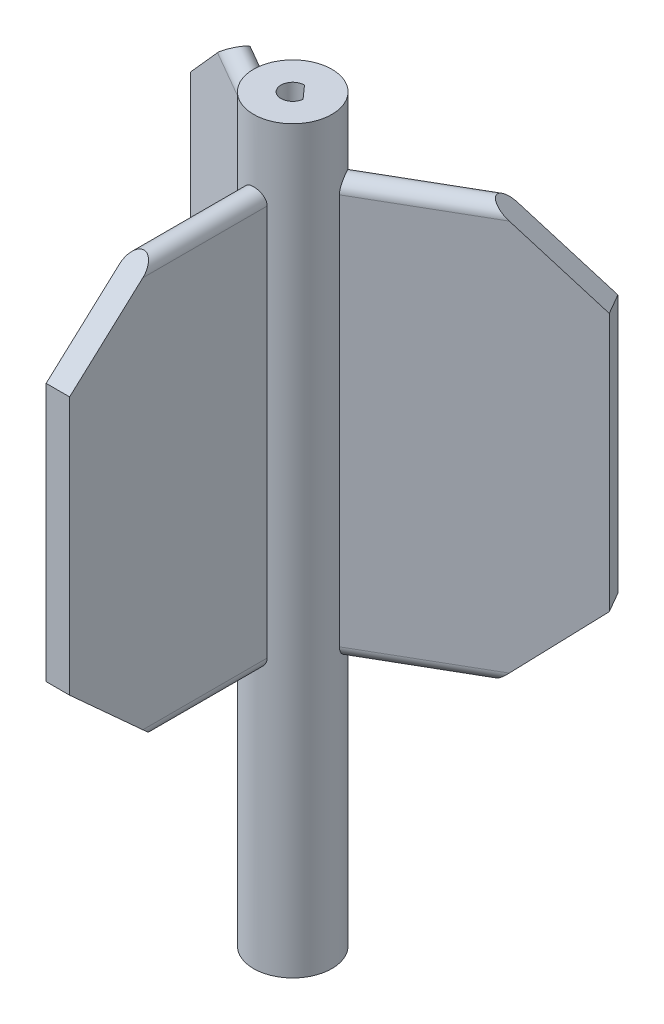
from build123d import *

# Parameters (mm, degrees)
SKETCH2_R           = 5
BOSS_EXTRUDE1_DEPTH = 94.5
BOSS_EXTRUDE2_DEPTH = 30
CUT_EXTRUDE5_REACH  = 101.36
CUT_EXTRUDE1_DEPTH  = 30
SKETCH7_R           = 2
CUT_EXTRUDE2_DEPTH  = 10
CIRPATTERN1_COUNT   = 3
CUT_EXTRUDE6_REACH  = 104.514
CUT_EXTRUDE7_REACH  = 105.272


with BuildPart() as part:
    # Sketch2 → Boss-Extrude1 (new body)
    with BuildSketch(Plane(origin=(0, 0, 0), x_dir=(1, 0, 0), z_dir=(0, 1, 0))):
        Circle(SKETCH2_R)
    extrude(amount=BOSS_EXTRUDE1_DEPTH)

    # Sketch3 → Boss-Extrude2 (add)
    with BuildSketch(Plane.XY):
        with BuildLine():
            Line((1.5, 85), (1.5, 35))
            ThreePointArc((1.5, 35), (0, 33.5), (-1.5, 35))
            Line((-1.5, 35), (-1.5, 85))
            ThreePointArc((-1.5, 85), (0, 86.5), (1.5, 85))
        make_face()
    boss_extrude2 = extrude(amount=BOSS_EXTRUDE2_DEPTH)

    # Sketch12 → Cut-Extrude5 (cut, up to next)
    with BuildSketch(Plane.ZY.offset(1.5), mode=Mode.PRIVATE) as cut_extrude5_sk1:
        Polygon((30, 86.5), (30, 76.5), (19, 86.5), align=None)
    cut_extrude5_tool1 = extrude(cut_extrude5_sk1.sketch, amount=-CUT_EXTRUDE5_REACH, mode=Mode.PRIVATE) & part.part
    # Sketch12 → Cut-Extrude5 (cut, up to next)
    with BuildSketch(Plane.ZY.offset(1.5), mode=Mode.PRIVATE) as cut_extrude5_sk2:
        Polygon((30, 33.5), (19, 33.5), (30, 43.5), align=None)
    cut_extrude5_tool2 = extrude(cut_extrude5_sk2.sketch, amount=-CUT_EXTRUDE5_REACH, mode=Mode.PRIVATE) & part.part
    add(cut_extrude5_tool1.solids().sort_by_distance((-1.5, 83.166667, 26.333333))[0], mode=Mode.SUBTRACT)
    add(cut_extrude5_tool2.solids().sort_by_distance((-1.5, 36.833333, 26.333333))[0], mode=Mode.SUBTRACT)

    # Sketch6 → Cut-Extrude1 (cut)
    with BuildSketch(Plane(origin=(0, 94.5, 0), x_dir=(1, 0, 0), z_dir=(0, 1, 0))):
        with BuildLine():
            Line((0, 1.5), (1.490044378, -0.172533333))
            ThreePointArc((1.490044378, -0.172533333), (-1.12, -0.997797575), (0, 1.5))
        make_face()
    extrude(amount=-CUT_EXTRUDE1_DEPTH, mode=Mode.SUBTRACT)

    # Sketch7 → Cut-Extrude2 (cut)
    with BuildSketch(Plane.XY):
        with Locations((0, 88.859096579)):
            Circle(SKETCH7_R)
    extrude(amount=-CUT_EXTRUDE2_DEPTH, mode=Mode.SUBTRACT)

    # CirPattern1: Boss-Extrude2 ×3 about axis
    cirpattern1_axis = Axis((0, 94.5, 0), (0, -1, 0))
    for i in range(1, CIRPATTERN1_COUNT):
        add(boss_extrude2.rotate(cirpattern1_axis, i * 360 / CIRPATTERN1_COUNT))

    # Sketch13 → Cut-Extrude6 (cut, up to next)
    with BuildSketch(Plane(origin=(0.75, 0, 1.299038106), x_dir=(0.8660254037844431, 0, -0.499999999999992), z_dir=(0.49999999999999206, 0, 0.8660254037844433)), mode=Mode.PRIVATE) as cut_extrude6_sk1:
        Polygon((30, 86.5), (30, 76.5), (19, 86.5), align=None)
    cut_extrude6_tool1 = extrude(cut_extrude6_sk1.sketch, amount=-CUT_EXTRUDE6_REACH, mode=Mode.PRIVATE) & part.part
    # Sketch13 → Cut-Extrude6 (cut, up to next)
    with BuildSketch(Plane(origin=(0.75, 0, 1.299038106), x_dir=(0.8660254037844431, 0, -0.499999999999992), z_dir=(0.49999999999999206, 0, 0.8660254037844433)), mode=Mode.PRIVATE) as cut_extrude6_sk2:
        Polygon((30, 33.5), (19, 33.5), (30, 43.5), align=None)
    cut_extrude6_tool2 = extrude(cut_extrude6_sk2.sketch, amount=-CUT_EXTRUDE6_REACH, mode=Mode.PRIVATE) & part.part
    add(cut_extrude6_tool1.solids().sort_by_distance((23.555336, 83.166667, -11.867629))[0], mode=Mode.SUBTRACT)
    add(cut_extrude6_tool2.solids().sort_by_distance((23.555336, 36.833333, -11.867629))[0], mode=Mode.SUBTRACT)

    # Sketch14 → Cut-Extrude7 (cut, up to next)
    with BuildSketch(Plane(origin=(0.75, 0, -1.299038106), x_dir=(-0.8660254037844363, 0, -0.5000000000000043), z_dir=(0.5000000000000042, 0, -0.8660254037844362)), mode=Mode.PRIVATE) as cut_extrude7_sk1:
        Polygon((30, 86.5), (30, 76.5), (19, 86.5), align=None)
    cut_extrude7_tool1 = extrude(cut_extrude7_sk1.sketch, amount=-CUT_EXTRUDE7_REACH, mode=Mode.PRIVATE) & part.part
    # Sketch14 → Cut-Extrude7 (cut, up to next)
    with BuildSketch(Plane(origin=(0.75, 0, -1.299038106), x_dir=(-0.8660254037844363, 0, -0.5000000000000043), z_dir=(0.5000000000000042, 0, -0.8660254037844362)), mode=Mode.PRIVATE) as cut_extrude7_sk2:
        Polygon((30, 33.5), (19, 33.5), (30, 43.5), align=None)
    cut_extrude7_tool2 = extrude(cut_extrude7_sk2.sketch, amount=-CUT_EXTRUDE7_REACH, mode=Mode.PRIVATE) & part.part
    add(cut_extrude7_tool1.solids().sort_by_distance((-22.055336, 83.166667, -14.465705))[0], mode=Mode.SUBTRACT)
    add(cut_extrude7_tool2.solids().sort_by_distance((-22.055336, 36.833333, -14.465705))[0], mode=Mode.SUBTRACT)


solid = part.part
